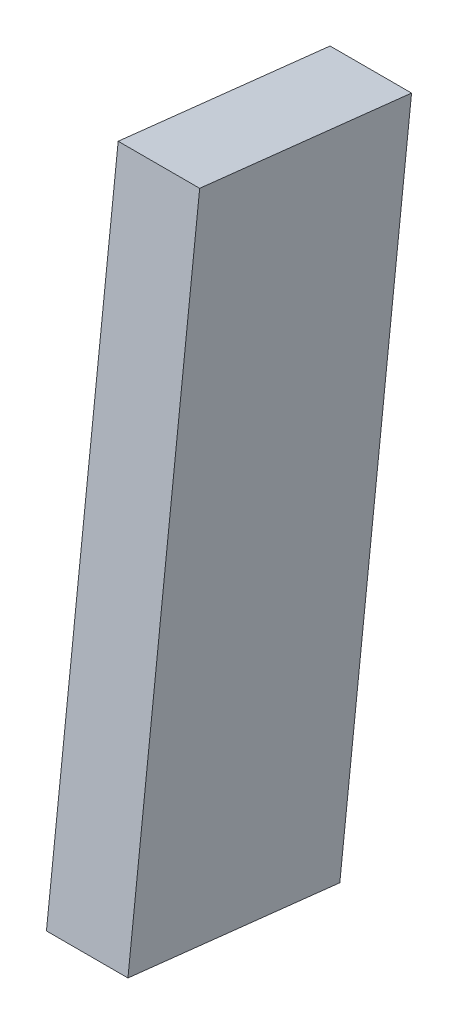
from build123d import *

# Parameters (mm, degrees)
BOSS_EXTRUDE1_DEPTH = 5


with BuildPart() as part:
    # Sketch1 → Boss-Extrude1 (new body)
    with BuildSketch(Plane(origin=(-1564.664133094, 0, 0), x_dir=(0, 0, -1), z_dir=(1, 0, 0))):
        Polygon((-1161.022108966, 412.819017175), (-1174.022108966, 414.258174103), (-1178.423396358, 374.501053114), (-1165.423396358, 373.061896186), align=None)
    extrude(amount=BOSS_EXTRUDE1_DEPTH)


solid = part.part
